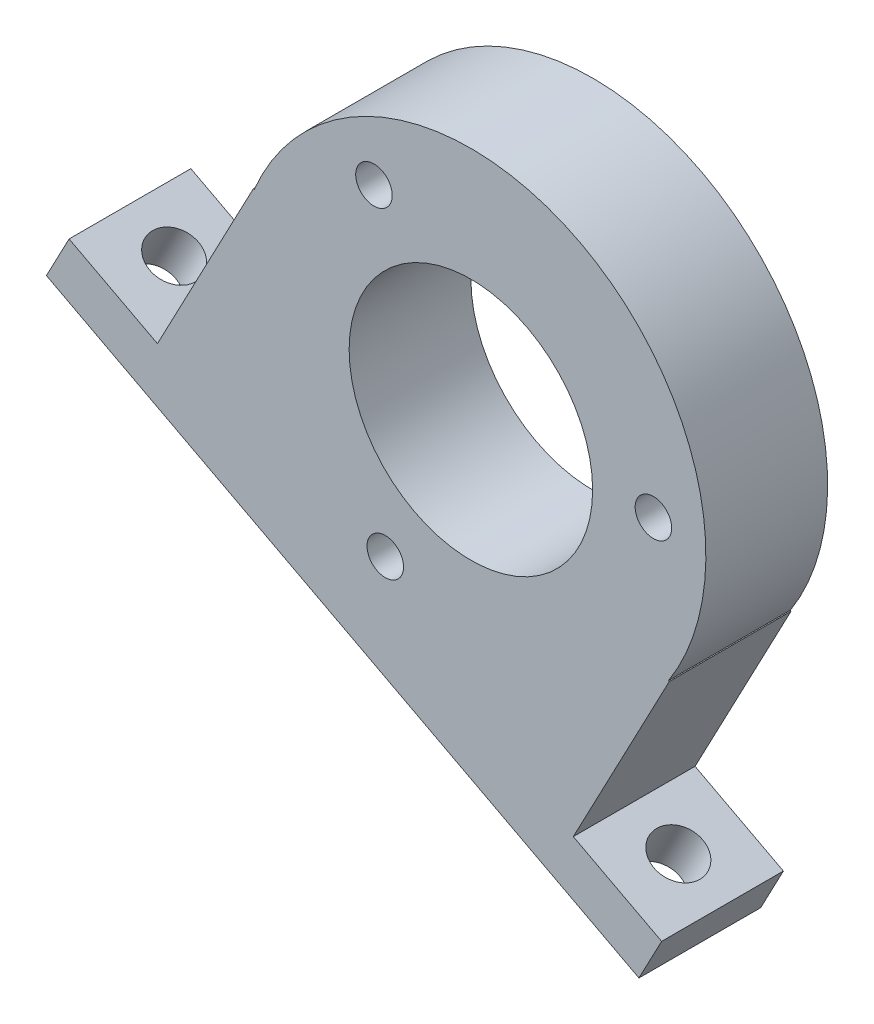
from build123d import *

# Parameters (mm, degrees)
SKETCH1_R           = 19.3
SKETCH1_R_2         = 10
SKETCH1_R_3         = 1.5
BOSS_EXTRUDE1_DEPTH = 10
SKETCH2_W           = 55
SKETCH2_H           = 10
BOSS_EXTRUDE2_DEPTH = 50
CUT_EXTRUDE1_DEPTH  = 50
SKETCH5_R           = 2
CUT_EXTRUDE2_DEPTH  = 50
SKETCH1_2_R         = 10
SKETCH1_2_R_2       = 1.5
CUT_EXTRUDE3_DEPTH  = 50


with BuildPart() as part:
    # Sketch1 → Boss-Extrude1 (new body)
    with BuildSketch(Plane.XY):
        with Locations((-14.127422454, 5.37928778)):
            Circle(SKETCH1_R)
        with Locations((-14.127422454, 5.37928778)):
            Circle(SKETCH1_R_2, mode=Mode.SUBTRACT)
        with Locations((0.862954929, 5.91648973)):
            Circle(SKETCH1_R_3, mode=Mode.SUBTRACT)
        with Locations((-22.08784168, 18.092734431)):
            Circle(SKETCH1_R_3, mode=Mode.SUBTRACT)
        with Locations((-21.15738061, -7.87136082)):
            Circle(SKETCH1_R_3, mode=Mode.SUBTRACT)
    extrude(amount=BOSS_EXTRUDE1_DEPTH)

    # Sketch2 → Boss-Extrude2 (add)
    with BuildSketch(Plane(origin=(-14.175728754, -26.918620376, 0), x_dir=(0.8848093624477475, -0.46595320808511503, 0), z_dir=(-0.46595320808511503, -0.8848093624477475, 0))):
        with Locations((-15.006572053, 5)):
            Rectangle(SKETCH2_W, SKETCH2_H)
    extrude(amount=-BOSS_EXTRUDE2_DEPTH)

    # Sketch4 → Cut-Extrude1 (cut)
    with BuildSketch(Plane(origin=(0, 0, 0), x_dir=(-1, 0, 0), z_dir=(0, 0, -1))):
        with BuildLine():
            Line((-20.176233667, 11.500494914), (-1.538105343, -23.891879583))
            Line((-1.538105343, -23.891879583), (5.717331429, -20.071063277))
            Line((5.717331429, -20.071063277), (-2.170378194, -5.092908386))
            Line((-2.170378194, -5.092908386), (-2.106184539, -5.059103093))
            ThreePointArc((-2.106184539, -5.059103093), (5.134525538, 22.456108476), (31.919069541, 12.859080153))
            Line((31.919069541, 12.859080153), (31.983263196, 12.892885446))
            Line((31.983263196, 12.892885446), (39.870972819, -2.085269445))
            Line((39.870972819, -2.085269445), (47.126409591, 1.735546861))
            Line((47.126409591, 1.735546861), (28.488281268, 37.127921359))
            Line((28.488281268, 37.127921359), (-20.176233667, 11.500494914))
        make_face()
        Polygon((48.990222424, -1.803690589), (0.325707489, -27.431117033), (3.121426738, -32.739973208), (51.785941672, -7.112546763), align=None)
    extrude(amount=-CUT_EXTRUDE1_DEPTH, mode=Mode.SUBTRACT)

    # Sketch5 → Cut-Extrude2 (cut)
    with BuildSketch(Plane(origin=(-9.516196674, -18.070526751, 0), x_dir=(0.8848093624477471, -0.4659532080851159, 0), z_dir=(0.4659532080851159, 0.8848093624477471, 0))):
        with Locations((-38.406572053, -5)):
            Circle(SKETCH5_R)
        with Locations((8.393427947, -5)):
            Circle(SKETCH5_R)
    extrude(amount=-CUT_EXTRUDE2_DEPTH, mode=Mode.SUBTRACT)

    # Sketch1<2> → Cut-Extrude3 (cut)
    with BuildSketch(Plane.XY):
        with Locations((-14.127422454, 5.37928778)):
            Circle(SKETCH1_2_R)
        with Locations((0.862954929, 5.91648973)):
            Circle(SKETCH1_2_R_2)
        with Locations((-22.08784168, 18.092734431)):
            Circle(SKETCH1_2_R_2)
        with Locations((-21.15738061, -7.87136082)):
            Circle(SKETCH1_2_R_2)
    extrude(amount=CUT_EXTRUDE3_DEPTH, mode=Mode.SUBTRACT)


solid = part.part
